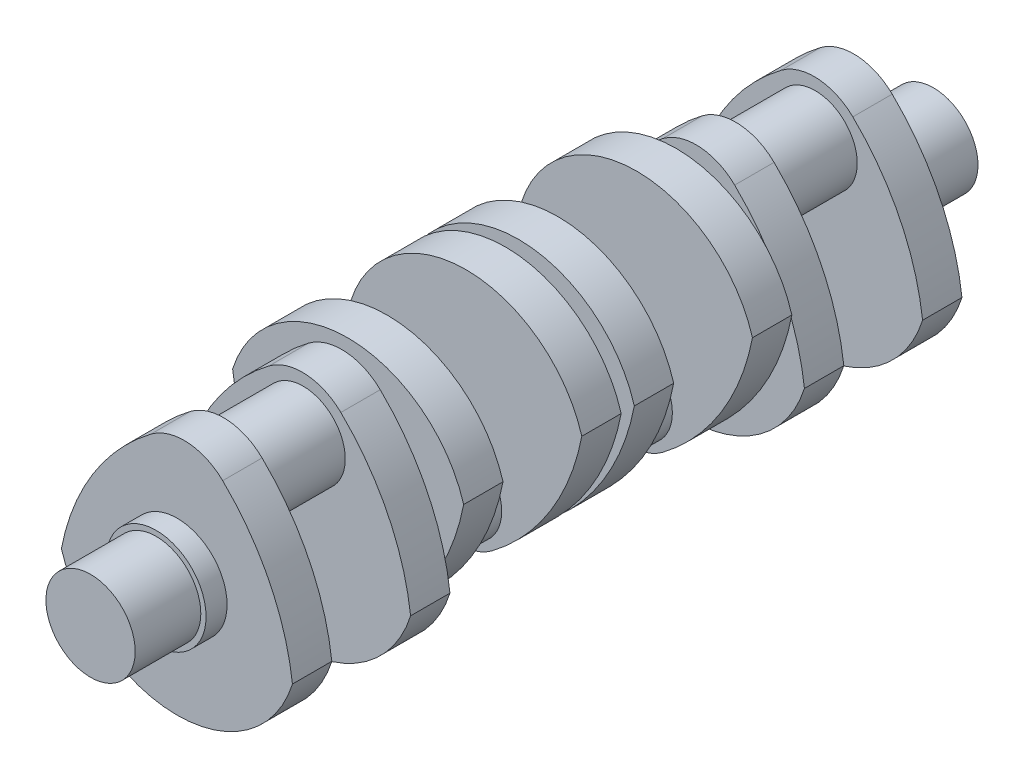
from build123d import *

# Parameters (mm, degrees)
SKETCH1_R           = 17
BOSS_EXTRUDE1_DEPTH = 25
SKETCH1_3_R         = 19
BOSS_EXTRUDE2_DEPTH = 8
BOSS_EXTRUDE3_DEPTH = 15
SKETCH3_R           = 16
BOSS_EXTRUDE4_DEPTH = 15
SKETCH4_R           = 16
BOSS_EXTRUDE5_DEPTH = 5
BOSS_EXTRUDE6_DEPTH = 15
SKETCH6_R           = 16
BOSS_EXTRUDE7_DEPTH = 15
BOSS_EXTRUDE8_START = 2.5
SKETCH7_R           = 17
BOSS_EXTRUDE8_DEPTH = 2.5


with BuildPart() as part:
    # Sketch1 → Boss-Extrude1 (new body)
    with BuildSketch(Plane.XY):
        Circle(SKETCH1_R)
    extrude(amount=-BOSS_EXTRUDE1_DEPTH)

    # Sketch1<3> → Boss-Extrude2 (add)
    with BuildSketch(Plane.XY):
        Circle(SKETCH1_3_R)
    extrude(amount=BOSS_EXTRUDE2_DEPTH)

    # Sketch2 → Boss-Extrude3 (add)
    with BuildSketch(Plane.XY.offset(8)):
        with BuildLine():
            ThreePointArc((-9.986058572, 41.752758122), (3.989062652, 45.958951954), (17.330326456, 40.042300883))
            ThreePointArc((17.330326456, 40.042300883), (35.227782907, 15.421350298), (43.89459329, -13.757350031))
            ThreePointArc((43.89459329, -13.757350031), (-0.356861624, -45.998615738), (-44.102758556, -13.074658228))
            ThreePointArc((-44.102758556, -13.074658228), (-32.131083622, 17.504265061), (-9.986058572, 41.752758122))
        make_face()
    boss_extrude3 = extrude(amount=BOSS_EXTRUDE3_DEPTH)

    # Sketch3 → Boss-Extrude4 (add)
    with BuildSketch(Plane.XY.offset(23)):
        with Locations((3.010021098, 25.549805608)):
            Circle(SKETCH3_R)
    boss_extrude4 = extrude(amount=BOSS_EXTRUDE4_DEPTH)

    # Mirror1: Boss-Extrude3, Boss-Extrude4 across plane
    add(boss_extrude3.mirror(Plane(origin=(3.010021098, 25.549805608, 38), x_dir=(1, 0, 0), z_dir=(0, 0, 1))))
    add(boss_extrude4.mirror(Plane(origin=(3.010021098, 25.549805608, 38), x_dir=(1, 0, 0), z_dir=(0, 0, 1))))

    # Sketch4 → Boss-Extrude5 (add)
    with BuildSketch(Plane.XY.offset(68)):
        Circle(SKETCH4_R)
    extrude(amount=BOSS_EXTRUDE5_DEPTH)

    # Sketch5 → Boss-Extrude6 (add)
    with BuildSketch(Plane.XY.offset(73)):
        with BuildLine():
            ThreePointArc((-17.330326456, -40.042300883), (-3.989062652, -45.958951954), (9.986058572, -41.752758122))
            ThreePointArc((9.986058572, -41.752758122), (32.131083622, -17.504265061), (44.102758556, 13.074658228))
            ThreePointArc((44.102758556, 13.074658228), (0.356861624, 45.998615738), (-43.89459329, 13.757350031))
            ThreePointArc((-43.89459329, 13.757350031), (-35.227782907, -15.421350298), (-17.330326456, -40.042300883))
        make_face()
    boss_extrude6 = extrude(amount=BOSS_EXTRUDE6_DEPTH)

    # Sketch6 → Boss-Extrude7 (add)
    with BuildSketch(Plane.XY.offset(88)):
        with Locations((-2.406352883, -26.965307304)):
            Circle(SKETCH6_R)
    boss_extrude7 = extrude(amount=BOSS_EXTRUDE7_DEPTH)

    # Mirror2: Boss-Extrude6, Boss-Extrude7 across plane
    add(boss_extrude6.mirror(Plane(origin=(-2.406352883, -26.965307304, 103), x_dir=(1, 0, 0), z_dir=(0, 0, 1))))
    add(boss_extrude7.mirror(Plane(origin=(-2.406352883, -26.965307304, 103), x_dir=(1, 0, 0), z_dir=(0, 0, 1))))

    # Sketch7 → Boss-Extrude8 (add)
    with BuildSketch(Plane.XY.offset(133).offset(BOSS_EXTRUDE8_START)):
        Circle(SKETCH7_R)
    extrude(amount=-BOSS_EXTRUDE8_DEPTH)

    # Mirror3: part across plane


with BuildPart() as part_1:
    add(part.part)
    add(part.part.mirror(Plane.XY.offset(135.5)))


solid = part_1.part
